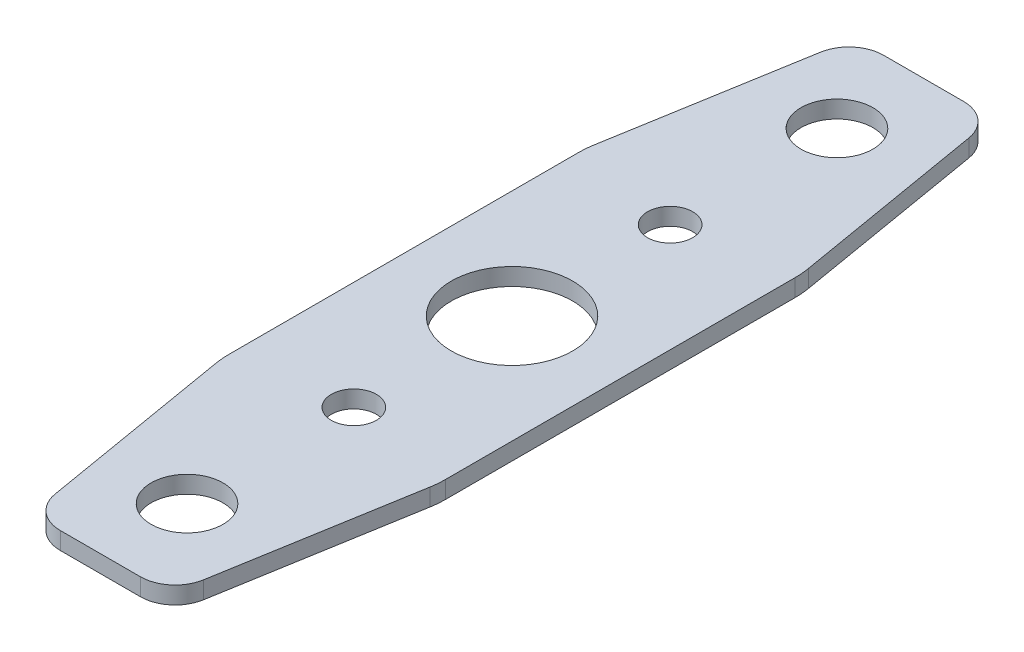
from build123d import *

# Parameters (mm, degrees)
SKETCH1_R           = 7
SKETCH1_R_2         = 4.15
SKETCH1_R_3         = 2.6
BOSS_EXTRUDE1_DEPTH = 2
FILLET1_R           = 10


with BuildPart() as part:
    # Sketch1 → Boss-Extrude1 (new body)
    with BuildSketch(Plane(origin=(0, 0, 0), x_dir=(1, 0, 0), z_dir=(0, 1, 0))):
        with BuildLine():
            Line((-4.621983379, 47.5), (4.621983379, 47.5))
            ThreePointArc((4.621983379, 47.5), (7.202813169, 46.556029711), (8.565529638, 44.169658799))
            Line((8.565529638, 44.169658799), (12.5, 21))
            Line((12.5, 21), (12.5, -21))
            Line((12.5, -21), (8.565529638, -44.169658799))
            ThreePointArc((8.565529638, -44.169658799), (7.202813169, -46.556029711), (4.621983379, -47.5))
            Line((4.621983379, -47.5), (-4.621983379, -47.5))
            ThreePointArc((-4.621983379, -47.5), (-7.202813169, -46.556029711), (-8.565529638, -44.169658799))
            Line((-8.565529638, -44.169658799), (-12.5, -21))
            Line((-12.5, -21), (-12.5, 21))
            Line((-12.5, 21), (-8.565529638, 44.169658799))
            ThreePointArc((-8.565529638, 44.169658799), (-7.202813169, 46.556029711), (-4.621983379, 47.5))
        make_face()
        with Locations(Location((0, 0, 0), (0, 0, 270))):
            Circle(SKETCH1_R, mode=Mode.SUBTRACT)
        with Locations(Location((0, 37.5, 0), (0, 0, 270))):
            Circle(SKETCH1_R_2, mode=Mode.SUBTRACT)
        with Locations(Location((0, -37.5, 0), (0, 0, 270))):
            Circle(SKETCH1_R_2, mode=Mode.SUBTRACT)
        with Locations(Location((0, 18.25, 0), (0, 0, 270))):
            Circle(SKETCH1_R_3, mode=Mode.SUBTRACT)
        with Locations(Location((0, -18.25, 0), (0, 0, 270))):
            Circle(SKETCH1_R_3, mode=Mode.SUBTRACT)
    extrude(amount=BOSS_EXTRUDE1_DEPTH)

    # Fillet1
    fillet1_edges = [part.edges().sort_by_distance(p)[0] for p in [
        (-12.5, 1, 21),
        (-12.5, 1, -21),
        (12.5, 1, -21),
        (12.5, 1, 21),
    ]]
    fillet(fillet1_edges, radius=FILLET1_R)


solid = part.part
